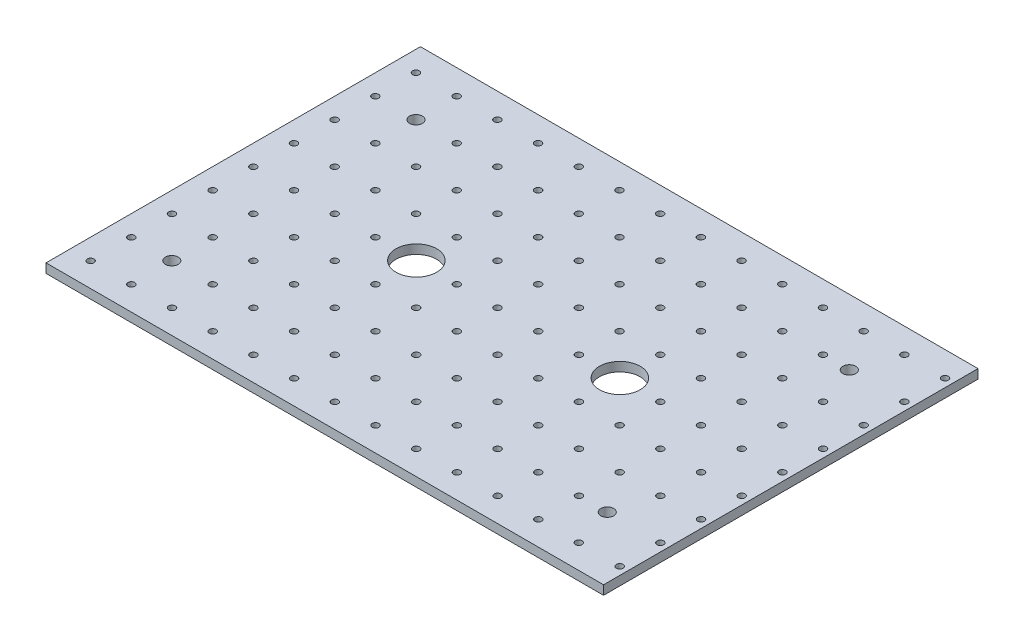
from build123d import *

# Parameters (mm, degrees)
SKETCH2_W           = 274
SKETCH2_H           = 184
SKETCH2_R           = 1.65
SKETCH2_R_2         = 1.649999999
SKETCH2_R_3         = 3.15
SKETCH2_R_4         = 10
BOSS_EXTRUDE1_DEPTH = 2.25


with BuildPart() as part:
    # Sketch2 → Boss-Extrude1 (new, symmetric)
    with BuildSketch(Plane(origin=(0, 0, 0), x_dir=(1, 0, 0), z_dir=(0, 1, 0))):
        Rectangle(SKETCH2_W, SKETCH2_H)
        with Locations(Location((-127, 79.807764932, 0), (0, 0, 270))):
            Circle(SKETCH2_R, mode=Mode.SUBTRACT)
        with Locations(Location((-87, 79.807764932, 0), (0, 0, 270))):
            Circle(SKETCH2_R, mode=Mode.SUBTRACT)
        with Locations(Location((-67, 79.807764932, 0), (0, 0, 270))):
            Circle(SKETCH2_R, mode=Mode.SUBTRACT)
        with Locations(Location((-47, 79.807764932, 0), (0, 0, 270))):
            Circle(SKETCH2_R, mode=Mode.SUBTRACT)
        with Locations(Location((-27, 79.807764932, 0), (0, 0, 270))):
            Circle(SKETCH2_R, mode=Mode.SUBTRACT)
        with Locations(Location((-7, 79.807764932, 0), (0, 0, 270))):
            Circle(SKETCH2_R, mode=Mode.SUBTRACT)
        with Locations(Location((13, 79.807764932, 0), (0, 0, 270))):
            Circle(SKETCH2_R, mode=Mode.SUBTRACT)
        with Locations(Location((33, 79.807764932, 0), (0, 0, 270))):
            Circle(SKETCH2_R, mode=Mode.SUBTRACT)
        with Locations(Location((53, 79.807764932, 0), (0, 0, 270))):
            Circle(SKETCH2_R, mode=Mode.SUBTRACT)
        with Locations(Location((73, 79.807764932, 0), (0, 0, 270))):
            Circle(SKETCH2_R, mode=Mode.SUBTRACT)
        with Locations(Location((93, 79.807764932, 0), (0, 0, 270))):
            Circle(SKETCH2_R, mode=Mode.SUBTRACT)
        with Locations(Location((133, 79.807764932, 0), (0, 0, 270))):
            Circle(SKETCH2_R, mode=Mode.SUBTRACT)
        with Locations(Location((-86.98479681, 59.807765022, 0), (0, 0, 270))):
            Circle(SKETCH2_R, mode=Mode.SUBTRACT)
        with Locations(Location((-66.98479681, 59.807765022, 0), (0, 0, 270))):
            Circle(SKETCH2_R, mode=Mode.SUBTRACT)
        with Locations(Location((-46.98479681, 59.807765022, 0), (0, 0, 270))):
            Circle(SKETCH2_R, mode=Mode.SUBTRACT)
        with Locations(Location((-26.98479681, 59.807765022, 0), (0, 0, 270))):
            Circle(SKETCH2_R, mode=Mode.SUBTRACT)
        with Locations(Location((-6.98479681, 59.807765022, 0), (0, 0, 270))):
            Circle(SKETCH2_R, mode=Mode.SUBTRACT)
        with Locations(Location((13.01520319, 59.807765022, 0), (0, 0, 270))):
            Circle(SKETCH2_R, mode=Mode.SUBTRACT)
        with Locations(Location((33.01520319, 59.807765022, 0), (0, 0, 270))):
            Circle(SKETCH2_R, mode=Mode.SUBTRACT)
        with Locations(Location((53.01520319, 59.807765022, 0), (0, 0, 270))):
            Circle(SKETCH2_R, mode=Mode.SUBTRACT)
        with Locations(Location((73.01520319, 59.807765022, 0), (0, 0, 270))):
            Circle(SKETCH2_R, mode=Mode.SUBTRACT)
        with Locations(Location((93.01520319, 59.807765022, 0), (0, 0, 270))):
            Circle(SKETCH2_R, mode=Mode.SUBTRACT)
        with Locations(Location((133.01520319, 59.807765022, 0), (0, 0, 270))):
            Circle(SKETCH2_R, mode=Mode.SUBTRACT)
        with Locations(Location((-106.96959362, 39.807765111, 0), (0, 0, 270))):
            Circle(SKETCH2_R, mode=Mode.SUBTRACT)
        with Locations(Location((-86.96959362, 39.807765111, 0), (0, 0, 270))):
            Circle(SKETCH2_R, mode=Mode.SUBTRACT)
        with Locations(Location((-66.96959362, 39.807765111, 0), (0, 0, 270))):
            Circle(SKETCH2_R, mode=Mode.SUBTRACT)
        with Locations(Location((-46.96959362, 39.807765111, 0), (0, 0, 270))):
            Circle(SKETCH2_R, mode=Mode.SUBTRACT)
        with Locations(Location((-26.96959362, 39.807765111, 0), (0, 0, 270))):
            Circle(SKETCH2_R, mode=Mode.SUBTRACT)
        with Locations(Location((-6.96959362, 39.807765111, 0), (0, 0, 270))):
            Circle(SKETCH2_R, mode=Mode.SUBTRACT)
        with Locations(Location((13.03040638, 39.807765111, 0), (0, 0, 270))):
            Circle(SKETCH2_R, mode=Mode.SUBTRACT)
        with Locations(Location((33.03040638, 39.807765111, 0), (0, 0, 270))):
            Circle(SKETCH2_R, mode=Mode.SUBTRACT)
        with Locations(Location((53.03040638, 39.807765111, 0), (0, 0, 270))):
            Circle(SKETCH2_R, mode=Mode.SUBTRACT)
        with Locations(Location((73.03040638, 39.807765111, 0), (0, 0, 270))):
            Circle(SKETCH2_R, mode=Mode.SUBTRACT)
        with Locations(Location((93.03040638, 39.807765111, 0), (0, 0, 270))):
            Circle(SKETCH2_R, mode=Mode.SUBTRACT)
        with Locations(Location((113.03040638, 39.807765111, 0), (0, 0, 270))):
            Circle(SKETCH2_R, mode=Mode.SUBTRACT)
        with Locations(Location((133.03040638, 39.807765111, 0), (0, 0, 270))):
            Circle(SKETCH2_R, mode=Mode.SUBTRACT)
        with Locations(Location((-106.954390429, 19.8077652, 0), (0, 0, 270))):
            Circle(SKETCH2_R, mode=Mode.SUBTRACT)
        with Locations(Location((-86.954390429, 19.8077652, 0), (0, 0, 270))):
            Circle(SKETCH2_R, mode=Mode.SUBTRACT)
        with Locations(Location((-66.954390429, 19.8077652, 0), (0, 0, 270))):
            Circle(SKETCH2_R, mode=Mode.SUBTRACT)
        with Locations(Location((-46.954390429, 19.8077652, 0), (0, 0, 270))):
            Circle(SKETCH2_R, mode=Mode.SUBTRACT)
        with Locations(Location((-26.954390429, 19.8077652, 0), (0, 0, 270))):
            Circle(SKETCH2_R, mode=Mode.SUBTRACT)
        with Locations(Location((-6.954390429, 19.8077652, 0), (0, 0, 270))):
            Circle(SKETCH2_R, mode=Mode.SUBTRACT)
        with Locations(Location((13.045609571, 19.8077652, 0), (0, 0, 270))):
            Circle(SKETCH2_R, mode=Mode.SUBTRACT)
        with Locations(Location((33.045609571, 19.8077652, 0), (0, 0, 270))):
            Circle(SKETCH2_R, mode=Mode.SUBTRACT)
        with Locations(Location((53.045609571, 19.8077652, 0), (0, 0, 270))):
            Circle(SKETCH2_R, mode=Mode.SUBTRACT)
        with Locations(Location((73.045609571, 19.8077652, 0), (0, 0, 270))):
            Circle(SKETCH2_R, mode=Mode.SUBTRACT)
        with Locations(Location((93.045609571, 19.8077652, 0), (0, 0, 270))):
            Circle(SKETCH2_R, mode=Mode.SUBTRACT)
        with Locations(Location((113.045609571, 19.8077652, 0), (0, 0, 270))):
            Circle(SKETCH2_R, mode=Mode.SUBTRACT)
        with Locations(Location((133.045609571, 19.8077652, 0), (0, 0, 270))):
            Circle(SKETCH2_R, mode=Mode.SUBTRACT)
        with Locations(Location((-106.939187239, -0.192234711, 0), (0, 0, 270))):
            Circle(SKETCH2_R, mode=Mode.SUBTRACT)
        with Locations(Location((-86.939187239, -0.192234711, 0), (0, 0, 270))):
            Circle(SKETCH2_R, mode=Mode.SUBTRACT)
        with Locations(Location((-66.939187239, -0.192234711, 0), (0, 0, 270))):
            Circle(SKETCH2_R, mode=Mode.SUBTRACT)
        with Locations(Location((-26.939187239, -0.192234711, 0), (0, 0, 270))):
            Circle(SKETCH2_R, mode=Mode.SUBTRACT)
        with Locations(Location((-6.939187239, -0.192234711, 0), (0, 0, 270))):
            Circle(SKETCH2_R, mode=Mode.SUBTRACT)
        with Locations(Location((13.060812761, -0.192234711, 0), (0, 0, 270))):
            Circle(SKETCH2_R, mode=Mode.SUBTRACT)
        with Locations(Location((33.060812761, -0.192234711, 0), (0, 0, 270))):
            Circle(SKETCH2_R, mode=Mode.SUBTRACT)
        with Locations(Location((73.060812761, -0.192234711, 0), (0, 0, 270))):
            Circle(SKETCH2_R, mode=Mode.SUBTRACT)
        with Locations(Location((93.060812761, -0.192234711, 0), (0, 0, 270))):
            Circle(SKETCH2_R, mode=Mode.SUBTRACT)
        with Locations(Location((113.060812761, -0.192234711, 0), (0, 0, 270))):
            Circle(SKETCH2_R, mode=Mode.SUBTRACT)
        with Locations(Location((133.060812761, -0.192234711, 0), (0, 0, 270))):
            Circle(SKETCH2_R, mode=Mode.SUBTRACT)
        with Locations(Location((-106.923984049, -20.192234622, 0), (0, 0, 270))):
            Circle(SKETCH2_R, mode=Mode.SUBTRACT)
        with Locations(Location((-86.923984049, -20.192234622, 0), (0, 0, 270))):
            Circle(SKETCH2_R, mode=Mode.SUBTRACT)
        with Locations(Location((-66.923984049, -20.192234622, 0), (0, 0, 270))):
            Circle(SKETCH2_R, mode=Mode.SUBTRACT)
        with Locations(Location((-46.923984049, -20.192234622, 0), (0, 0, 270))):
            Circle(SKETCH2_R, mode=Mode.SUBTRACT)
        with Locations(Location((-26.923984049, -20.192234622, 0), (0, 0, 270))):
            Circle(SKETCH2_R, mode=Mode.SUBTRACT)
        with Locations(Location((-6.923984049, -20.192234622, 0), (0, 0, 270))):
            Circle(SKETCH2_R, mode=Mode.SUBTRACT)
        with Locations(Location((13.076015951, -20.192234622, 0), (0, 0, 270))):
            Circle(SKETCH2_R, mode=Mode.SUBTRACT)
        with Locations(Location((33.076015951, -20.192234622, 0), (0, 0, 270))):
            Circle(SKETCH2_R, mode=Mode.SUBTRACT)
        with Locations(Location((53.076015951, -20.192234622, 0), (0, 0, 270))):
            Circle(SKETCH2_R, mode=Mode.SUBTRACT)
        with Locations(Location((73.076015951, -20.192234622, 0), (0, 0, 270))):
            Circle(SKETCH2_R, mode=Mode.SUBTRACT)
        with Locations(Location((93.076015951, -20.192234622, 0), (0, 0, 270))):
            Circle(SKETCH2_R, mode=Mode.SUBTRACT)
        with Locations(Location((113.076015951, -20.192234622, 0), (0, 0, 270))):
            Circle(SKETCH2_R, mode=Mode.SUBTRACT)
        with Locations(Location((133.076015951, -20.192234622, 0), (0, 0, 270))):
            Circle(SKETCH2_R, mode=Mode.SUBTRACT)
        with Locations(Location((-106.908780859, -40.192234532, 0), (0, 0, 270))):
            Circle(SKETCH2_R_2, mode=Mode.SUBTRACT)
        with Locations(Location((-86.908780859, -40.192234532, 0), (0, 0, 270))):
            Circle(SKETCH2_R_2, mode=Mode.SUBTRACT)
        with Locations(Location((-66.908780859, -40.192234532, 0), (0, 0, 270))):
            Circle(SKETCH2_R_2, mode=Mode.SUBTRACT)
        with Locations(Location((-46.908780859, -40.192234532, 0), (0, 0, 270))):
            Circle(SKETCH2_R_2, mode=Mode.SUBTRACT)
        with Locations(Location((-26.908780859, -40.192234532, 0), (0, 0, 270))):
            Circle(SKETCH2_R_2, mode=Mode.SUBTRACT)
        with Locations(Location((-6.908780859, -40.192234532, 0), (0, 0, 270))):
            Circle(SKETCH2_R_2, mode=Mode.SUBTRACT)
        with Locations(Location((13.091219141, -40.192234532, 0), (0, 0, 270))):
            Circle(SKETCH2_R_2, mode=Mode.SUBTRACT)
        with Locations(Location((33.091219141, -40.192234532, 0), (0, 0, 270))):
            Circle(SKETCH2_R_2, mode=Mode.SUBTRACT)
        with Locations(Location((53.091219141, -40.192234532, 0), (0, 0, 270))):
            Circle(SKETCH2_R_2, mode=Mode.SUBTRACT)
        with Locations(Location((73.091219141, -40.192234532, 0), (0, 0, 270))):
            Circle(SKETCH2_R_2, mode=Mode.SUBTRACT)
        with Locations(Location((93.091219141, -40.192234532, 0), (0, 0, 270))):
            Circle(SKETCH2_R_2, mode=Mode.SUBTRACT)
        with Locations(Location((113.091219141, -40.192234532, 0), (0, 0, 270))):
            Circle(SKETCH2_R_2, mode=Mode.SUBTRACT)
        with Locations(Location((133.091219141, -40.192234532, 0), (0, 0, 270))):
            Circle(SKETCH2_R_2, mode=Mode.SUBTRACT)
        with Locations(Location((-86.893577669, -60.192234443, 0), (0, 0, 270))):
            Circle(SKETCH2_R_2, mode=Mode.SUBTRACT)
        with Locations(Location((-66.893577669, -60.192234443, 0), (0, 0, 270))):
            Circle(SKETCH2_R_2, mode=Mode.SUBTRACT)
        with Locations(Location((-46.893577669, -60.192234443, 0), (0, 0, 270))):
            Circle(SKETCH2_R_2, mode=Mode.SUBTRACT)
        with Locations(Location((-26.893577669, -60.192234443, 0), (0, 0, 270))):
            Circle(SKETCH2_R_2, mode=Mode.SUBTRACT)
        with Locations(Location((-6.893577669, -60.192234443, 0), (0, 0, 270))):
            Circle(SKETCH2_R_2, mode=Mode.SUBTRACT)
        with Locations(Location((13.106422331, -60.192234443, 0), (0, 0, 270))):
            Circle(SKETCH2_R_2, mode=Mode.SUBTRACT)
        with Locations(Location((33.106422331, -60.192234443, 0), (0, 0, 270))):
            Circle(SKETCH2_R_2, mode=Mode.SUBTRACT)
        with Locations(Location((53.106422331, -60.192234443, 0), (0, 0, 270))):
            Circle(SKETCH2_R_2, mode=Mode.SUBTRACT)
        with Locations(Location((73.106422331, -60.192234443, 0), (0, 0, 270))):
            Circle(SKETCH2_R_2, mode=Mode.SUBTRACT)
        with Locations(Location((93.106422331, -60.192234443, 0), (0, 0, 270))):
            Circle(SKETCH2_R_2, mode=Mode.SUBTRACT)
        with Locations(Location((133.106422331, -60.192234443, 0), (0, 0, 270))):
            Circle(SKETCH2_R_2, mode=Mode.SUBTRACT)
        with Locations(Location((-86.878374479, -80.192234354, 0), (0, 0, 270))):
            Circle(SKETCH2_R_2, mode=Mode.SUBTRACT)
        with Locations(Location((-66.878374479, -80.192234354, 0), (0, 0, 270))):
            Circle(SKETCH2_R_2, mode=Mode.SUBTRACT)
        with Locations(Location((-46.878374479, -80.192234354, 0), (0, 0, 270))):
            Circle(SKETCH2_R_2, mode=Mode.SUBTRACT)
        with Locations(Location((-26.878374479, -80.192234354, 0), (0, 0, 270))):
            Circle(SKETCH2_R_2, mode=Mode.SUBTRACT)
        with Locations(Location((-6.878374479, -80.192234354, 0), (0, 0, 270))):
            Circle(SKETCH2_R_2, mode=Mode.SUBTRACT)
        with Locations(Location((13.121625521, -80.192234354, 0), (0, 0, 270))):
            Circle(SKETCH2_R_2, mode=Mode.SUBTRACT)
        with Locations(Location((33.121625521, -80.192234354, 0), (0, 0, 270))):
            Circle(SKETCH2_R_2, mode=Mode.SUBTRACT)
        with Locations(Location((53.121625521, -80.192234354, 0), (0, 0, 270))):
            Circle(SKETCH2_R_2, mode=Mode.SUBTRACT)
        with Locations(Location((73.121625521, -80.192234354, 0), (0, 0, 270))):
            Circle(SKETCH2_R_2, mode=Mode.SUBTRACT)
        with Locations(Location((93.121625521, -80.192234354, 0), (0, 0, 270))):
            Circle(SKETCH2_R_2, mode=Mode.SUBTRACT)
        with Locations(Location((133.121625521, -80.192234354, 0), (0, 0, 270))):
            Circle(SKETCH2_R_2, mode=Mode.SUBTRACT)
        with Locations(Location((-126.98479681, 59.807765022, 0), (0, 0, 270))):
            Circle(SKETCH2_R, mode=Mode.SUBTRACT)
        with Locations(Location((-126.96959362, 39.807765111, 0), (0, 0, 270))):
            Circle(SKETCH2_R, mode=Mode.SUBTRACT)
        with Locations(Location((-126.954390429, 19.8077652, 0), (0, 0, 270))):
            Circle(SKETCH2_R, mode=Mode.SUBTRACT)
        with Locations(Location((-126.939187239, -0.192234711, 0), (0, 0, 270))):
            Circle(SKETCH2_R, mode=Mode.SUBTRACT)
        with Locations(Location((-126.923984049, -20.192234622, 0), (0, 0, 270))):
            Circle(SKETCH2_R, mode=Mode.SUBTRACT)
        with Locations(Location((-126.908780859, -40.192234532, 0), (0, 0, 270))):
            Circle(SKETCH2_R_2, mode=Mode.SUBTRACT)
        with Locations(Location((-126.893577669, -60.192234443, 0), (0, 0, 270))):
            Circle(SKETCH2_R_2, mode=Mode.SUBTRACT)
        with Locations(Location((-126.878374479, -80.192234354, 0), (0, 0, 270))):
            Circle(SKETCH2_R_2, mode=Mode.SUBTRACT)
        with Locations(Location((-107, 59.807764932, 0), (0, 0, 270))):
            Circle(SKETCH2_R_3, mode=Mode.SUBTRACT)
        with Locations(Location((-107, -60.192235068, 0), (0, 0, 270))):
            Circle(SKETCH2_R_3, mode=Mode.SUBTRACT)
        with Locations(Location((107, -60.192235068, 0), (0, 0, 270))):
            Circle(SKETCH2_R_3, mode=Mode.SUBTRACT)
        with Locations(Location((105.938185762, 59.807764932, 0), (0, 0, 270))):
            Circle(SKETCH2_R_3, mode=Mode.SUBTRACT)
        with Locations(Location((53, 0, 0), (0, 0, 270))):
            Circle(SKETCH2_R_4, mode=Mode.SUBTRACT)
        with Locations(Location((-47, 0, 0), (0, 0, 270))):
            Circle(SKETCH2_R_4, mode=Mode.SUBTRACT)
        with Locations(Location((113, -80.192235068, 0), (0, 0, 270))):
            Circle(SKETCH2_R, mode=Mode.SUBTRACT)
        with Locations(Location((113, 79.807764932, 0), (0, 0, 270))):
            Circle(SKETCH2_R, mode=Mode.SUBTRACT)
        with Locations(Location((-106.878374479, -80.192235068, 0), (0, 0, 270))):
            Circle(SKETCH2_R, mode=Mode.SUBTRACT)
        with Locations(Location((-107, 79.807764932, 0), (0, 0, 270))):
            Circle(SKETCH2_R, mode=Mode.SUBTRACT)
    extrude(amount=BOSS_EXTRUDE1_DEPTH, both=True)


solid = part.part
